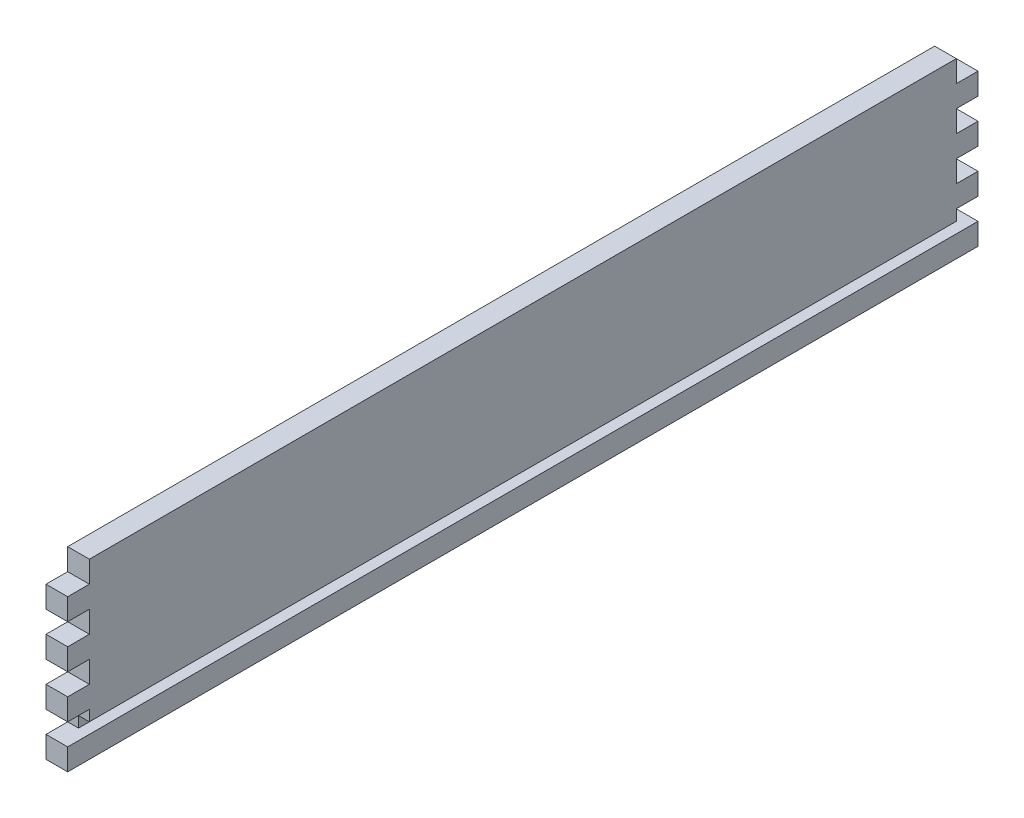
from build123d import *

# Parameters (mm, degrees)
BOSS_EXTRUDE1_DEPTH = 12.7
SKETCH2_W           = 579.235214512
SKETCH2_H           = 6.35
CUT_EXTRUDE1_DEPTH  = 6.35


with BuildPart() as part:
    # Sketch1 → Boss-Extrude1 (new body)
    with BuildSketch(Plane(origin=(0, 0, 0), x_dir=(0, 0, -1), z_dir=(1, 0, 0))):
        Polygon((520.7, 25.4), (533.4, 25.4), (533.4, 38.1), (520.7, 38.1), (520.7, 50.8), (533.4, 50.8), (533.4, 63.5), (520.7, 63.5), (520.7, 76.2), (533.4, 76.2), (533.4, 88.9), (520.7, 88.9), (520.7, 101.6), (12.7, 101.6), (12.7, 88.9), (0, 88.9), (0, 76.2), (12.7, 76.2), (12.7, 63.5), (0, 63.5), (0, 50.8), (12.7, 50.8), (12.7, 38.1), (0, 38.1), (0, 25.4), (12.7, 25.4), (12.7, 12.7), (0, 12.7), (0, 0), (533.4, 0), (533.4, 12.7), (520.7, 12.7), align=None)
    extrude(amount=BOSS_EXTRUDE1_DEPTH)

    # Sketch2 → Cut-Extrude1 (cut)
    with BuildSketch(Plane(origin=(12.7, 0, 0), x_dir=(0, 0, -1), z_dir=(1, 0, 0))):
        with Locations((278.780841046, 15.875)):
            Rectangle(SKETCH2_W, SKETCH2_H)
    extrude(amount=-CUT_EXTRUDE1_DEPTH, mode=Mode.SUBTRACT)


solid = part.part
